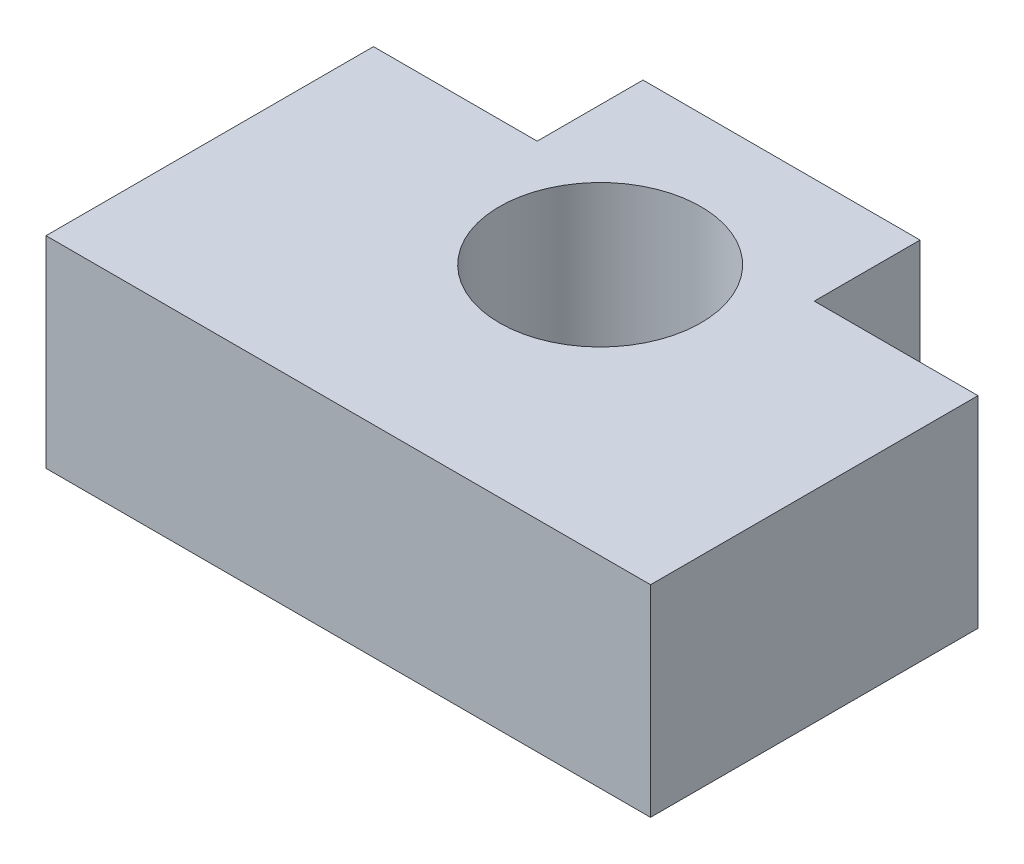
from build123d import *

# Parameters (mm, degrees)
BOSS_EXTRUDE1_DEPTH = 20
SKETCH2_R           = 10
CUT_EXTRUDE1_DEPTH  = 77.47875522


with BuildPart() as part:
    # Sketch1 → Boss-Extrude1 (new body)
    with BuildSketch(Plane(origin=(0, 0, 0), x_dir=(1, 0, 0), z_dir=(0, 1, 0))):
        Polygon((0, 32.5), (0, 0), (60, 0), (60, 32.5), (43.75, 32.5), (43.75, 43), (16.25, 43), (16.25, 32.5), align=None)
    extrude(amount=BOSS_EXTRUDE1_DEPTH)

    # Sketch2 → Cut-Extrude1 (cut, through all)
    with BuildSketch(Plane(origin=(0, 20, 0), x_dir=(1, 0, 0), z_dir=(0, 1, 0))):
        with Locations(Location((30, 25, 0), (0, 0, 270))):
            Circle(SKETCH2_R)
    extrude(amount=-CUT_EXTRUDE1_DEPTH, mode=Mode.SUBTRACT)


solid = part.part
